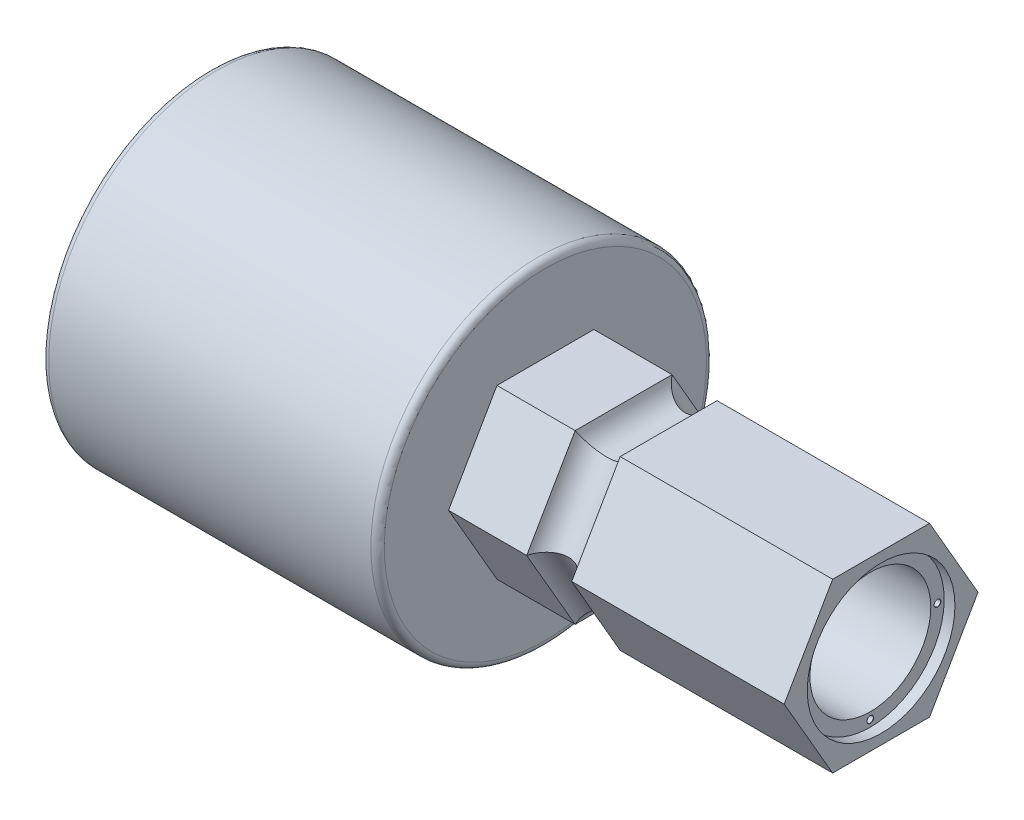
from build123d import *

# Parameters (mm, degrees)
BOSS_EXTRUDE3_DEPTH = 50
BOSS_EXTRUDE4_START = -53
SKETCH6_R           = 12.5
SKETCH6_R_2         = 9
BOSS_EXTRUDE4_DEPTH = 53
SKETCH3_W           = 3.5
SKETCH3_H           = 14.43375673
CIRPATTERN4_COUNT   = 6
FILLET1_R           = 1
SKETCH8_R           = 11
CUT_EXTRUDE1_DEPTH  = 1.6
CIRPATTERN5_COUNT   = 4


with BuildPart() as part:
    # Sketch1 → Revolve1 (revolve)
    with BuildSketch(Plane.XY):
        with BuildLine():
            ThreePointArc((0, 2), (0.292893219, 2.707106781), (1, 3))
            Line((1, 3), (49, 3))
            ThreePointArc((49, 3), (49.707106781, 2.707106781), (50, 2))
            Line((50, 2), (50, -12))
            Line((50, -12), (48, -12))
            ThreePointArc((48, -12), (47.292893219, -11.707106781), (47, -11))
            Line((47, -11), (47, -1))
            ThreePointArc((47, -1), (46.707106781, -0.292893219), (46, 0))
            Line((46, 0), (0, 0))
            Line((0, 0), (0, 2))
        make_face()
    revolve(axis=Axis((50, -22, 0), (-1, 0, 0)))

    # Sketch2 → Boss-Extrude3 (add)
    with BuildSketch(Plane(origin=(50, 0, 0), x_dir=(0, 0, -1), z_dir=(1, 0, 0))):
        Polygon((14.43375673, -22), (7.216878365, -9.5), (-7.216878365, -9.5), (-14.43375673, -22), (-7.216878365, -34.5), (7.216878365, -34.5), align=None)
        Polygon((11.547005384, -22), (5.773502692, -12), (-5.773502692, -12), (-11.547005384, -22), (-5.773502692, -32), (5.773502692, -32), align=None, mode=Mode.SUBTRACT)
    extrude(amount=BOSS_EXTRUDE3_DEPTH)

    # Sketch6 → Boss-Extrude4 (add)
    with BuildSketch(Plane.ZY.offset(-47).offset(BOSS_EXTRUDE4_START)):
        with Locations((0, -22)):
            Circle(SKETCH6_R)
        with Locations(Location((0, -22, 0), (0, 0, 270))):
            Circle(SKETCH6_R_2, mode=Mode.SUBTRACT)
    extrude(amount=BOSS_EXTRUDE4_DEPTH)

    # Sketch3 → Cut-Revolve3 (revolve, cut)
    with BuildSketch(Plane(origin=(0, -8.5, 0), x_dir=(1, 0, 0), z_dir=(0, 1, 0))):
        with Locations((66.75, 0)):
            Rectangle(SKETCH3_W, SKETCH3_H)
    cut_revolve3 = revolve(axis=Axis((65, -8.5, -7.216878365), (0, 0, 1)), mode=Mode.SUBTRACT)

    # CirPattern4: Cut-Revolve3 ×6 about axis
    cirpattern4_axis = Axis((0, -22, 0), (-1, 0, 0))
    for i in range(1, CIRPATTERN4_COUNT):
        add(cut_revolve3.rotate(cirpattern4_axis, i * 360 / CIRPATTERN4_COUNT), mode=Mode.SUBTRACT)

    # Fillet1
    fillet1_edges = [part.edges().sort_by_distance(p)[0] for p in [
        (47, -13, 0),
    ]]
    fillet(fillet1_edges, radius=FILLET1_R)

    # Sketch8 → Cut-Extrude1 (cut)
    with BuildSketch(Plane(origin=(100, 0, 0), x_dir=(0, 0, -1), z_dir=(1, 0, 0))):
        with Locations((0, -22)):
            Circle(SKETCH8_R)
    extrude(amount=-CUT_EXTRUDE1_DEPTH, mode=Mode.SUBTRACT)

    # Sketch10 → Tap Drill for M1.2x0.25 Tap1 (revolve, cut)
    with BuildSketch(Plane(origin=(98.4, -12, 0), x_dir=(0, 0, -1), z_dir=(0, 1, 0))):
        Polygon((0, 0), (0, 2.285408794), (0.475, 2), (0.475, 0.025), (0.5, 0), align=None)
    tap_drill_for_m1_2x0_25_tap1 = revolve(axis=Axis((104.75, -12, 0), (-1, 0, 0)), mode=Mode.SUBTRACT)

    # CirPattern5: Tap Drill for M1.2x0.25 Tap1 ×4 about axis
    cirpattern5_axis = Axis((0, -22, 0), (1, 0, 0))
    for i in range(1, CIRPATTERN5_COUNT):
        add(tap_drill_for_m1_2x0_25_tap1.rotate(cirpattern5_axis, i * 360 / CIRPATTERN5_COUNT), mode=Mode.SUBTRACT)


solid = part.part
